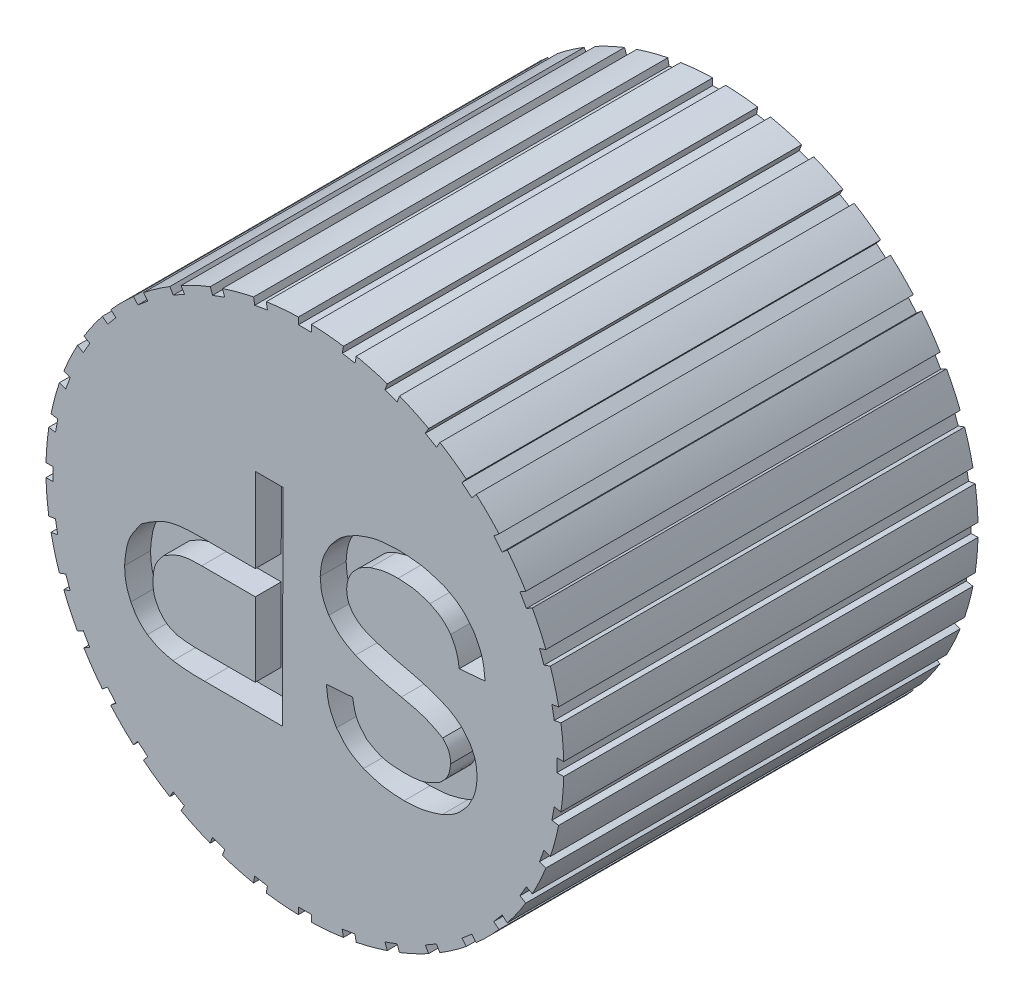
from build123d import *

# Parameters (mm, degrees)
SKETCH1_W                    = 10.000000149
SKETCH1_H                    = 16
CUT_EXTRUDE1_DEPTH           = 16
CUT_EXTRUDE2_DEPTH           = 16
CUT_EXTRUDE3_DEPTH           = 16
CUT_EXTRUDE4_DEPTH           = 16
CUT_EXTRUDE5_DEPTH           = 16
CUT_EXTRUDE6_DEPTH           = 16
CUT_EXTRUDE7_DEPTH           = 16
CUT_EXTRUDE8_DEPTH           = 16
CUT_EXTRUDE9_DEPTH           = 16
CUT_EXTRUDE10_DEPTH          = 16
CUT_EXTRUDE11_DEPTH          = 16
CUT_EXTRUDE12_DEPTH          = 16
CUT_EXTRUDE13_DEPTH          = 16
CUT_EXTRUDE14_DEPTH          = 16
CUT_EXTRUDE15_DEPTH          = 16
CUT_EXTRUDE16_DEPTH          = 16
CUT_EXTRUDE17_DEPTH          = 16
CUT_EXTRUDE18_DEPTH          = 16
CUT_EXTRUDE19_DEPTH          = 16
CUT_EXTRUDE20_DEPTH          = 16
CUT_EXTRUDE21_DEPTH          = 16
CUT_EXTRUDE22_DEPTH          = 16
CUT_EXTRUDE23_DEPTH          = 16
CUT_EXTRUDE24_DEPTH          = 16
CUT_EXTRUDE25_DEPTH          = 16
CUT_EXTRUDE26_DEPTH          = 16
CUT_EXTRUDE27_DEPTH          = 16
CUT_EXTRUDE28_DEPTH          = 16
CUT_EXTRUDE29_DEPTH          = 16
CUT_EXTRUDE30_DEPTH          = 16
CUT_EXTRUDE31_DEPTH          = 16
CUT_EXTRUDE32_DEPTH          = 16
CUT_EXTRUDE33_DEPTH          = 16
CUT_EXTRUDE34_DEPTH          = 16
CUT_EXTRUDE35_DEPTH          = 16
CUT_EXTRUDE36_DEPTH          = 16
F_6_0_6_DIAMETER_HOLE1_D     = 6
F_6_0_6_DIAMETER_HOLE1_DEPTH = 14
BOSS_EXTRUDE1_DEPTH          = 11.5
CUT_EXTRUDE37_START          = 3
CUT_EXTRUDE37_DEPTH          = 1
BOSS_EXTRUDE2_START          = 2.999997
BOSS_EXTRUDE2_DEPTH          = 1
CUT_EXTRUDE38_START          = 3
CUT_EXTRUDE38_DEPTH          = 1


with BuildPart() as part:
    # Sketch1 → Revolve1 (revolve)
    with BuildSketch(Plane(origin=(0, 0, 0), x_dir=(1, 0, 0), z_dir=(0, 1, 0))):
        with Locations((5.000000074, -8)):
            Rectangle(SKETCH1_W, SKETCH1_H)
    revolve(axis=Axis((0, 0, 0), (0, 0, 1)))

    # Sketch2 → Cut-Extrude1 (cut)
    with BuildSketch(Plane(origin=(0, 0, 0), x_dir=(-1, 0, 0), z_dir=(0, 0, -1))):
        with BuildLine():
            Line((3.182999705, 9.479900625), (3.093633551, 9.234369134))
            Line((3.093633551, 9.234369134), (3.563197034, 9.063462003))
            Line((3.563197034, 9.063462003), (3.65258757, 9.30906048))
            ThreePointArc((3.65258757, 9.30906048), (3.418860912, 9.397414168), (3.182999705, 9.479900625))
        make_face()
    extrude(amount=-CUT_EXTRUDE1_DEPTH, mode=Mode.SUBTRACT)

    # Sketch3 → Cut-Extrude2 (cut)
    with BuildSketch(Plane(origin=(0, 0, 0), x_dir=(-1, 0, 0), z_dir=(0, 0, -1))):
        with BuildLine():
            Line((4.780810256, 8.783157535), (4.650165678, 8.556874488))
            Line((4.650165678, 8.556874488), (5.082917725, 8.307024978))
            Line((5.082917725, 8.307024978), (5.213597945, 8.533369759))
            ThreePointArc((5.213597945, 8.533369759), (4.998764578, 8.660967364), (4.780810256, 8.783157535))
        make_face()
    extrude(amount=-CUT_EXTRUDE2_DEPTH, mode=Mode.SUBTRACT)

    # Sketch4 → Cut-Extrude3 (cut)
    with BuildSketch(Plane(origin=(0, 0, 0), x_dir=(-1, 0, 0), z_dir=(0, 0, -1))):
        with BuildLine():
            Line((6.233358306, 7.819542647), (6.065404874, 7.619383542))
            Line((6.065404874, 7.619383542), (6.448196533, 7.298183202))
            Line((6.448196533, 7.298183202), (6.616195786, 7.498396916))
            ThreePointArc((6.616195786, 7.498396916), (6.426783311, 7.661361449), (6.233358306, 7.819542647))
        make_face()
    extrude(amount=-CUT_EXTRUDE3_DEPTH, mode=Mode.SUBTRACT)

    # Sketch5 → Cut-Extrude4 (cut)
    with BuildSketch(Plane(origin=(0, 0, 0), x_dir=(-1, 0, 0), z_dir=(0, 0, -1))):
        with BuildLine():
            Line((7.496508918, 6.618334914), (7.296349812, 6.450381482))
            Line((7.296349812, 6.450381482), (7.617550152, 6.067589824))
            Line((7.617550152, 6.067589824), (7.817763865, 6.235589077))
            ThreePointArc((7.817763865, 6.235589077), (7.659527486, 6.428968943), (7.496508918, 6.618334914))
        make_face()
    extrude(amount=-CUT_EXTRUDE4_DEPTH, mode=Mode.SUBTRACT)

    # Sketch6 → Cut-Extrude5 (cut)
    with BuildSketch(Plane(origin=(0, 0, 0), x_dir=(-1, 0, 0), z_dir=(0, 0, -1))):
        with BuildLine():
            Line((8.531881899, 5.216032423), (8.305598853, 5.085387845))
            Line((8.305598853, 5.085387845), (8.555448364, 4.652635798))
            Line((8.555448364, 4.652635798), (8.781793145, 4.783316019))
            ThreePointArc((8.781793145, 4.783316019), (8.659540794, 5.001235469), (8.531881899, 5.216032423))
        make_face()
    extrude(amount=-CUT_EXTRUDE5_DEPTH, mode=Mode.SUBTRACT)

    # Sketch7 → Cut-Extrude6 (cut)
    with BuildSketch(Plane(origin=(0, 0, 0), x_dir=(-1, 0, 0), z_dir=(0, 0, -1))):
        with BuildLine():
            Line((9.308017967, 3.655243426), (9.062486476, 3.565877272))
            Line((9.062486476, 3.565877272), (9.233393607, 3.096313789))
            Line((9.233393607, 3.096313789), (9.478992085, 3.185704324))
            ThreePointArc((9.478992085, 3.185704324), (9.396438337, 3.421541987), (9.308017967, 3.655243426))
        make_face()
    extrude(amount=-CUT_EXTRUDE6_DEPTH, mode=Mode.SUBTRACT)

    # Sketch8 → Cut-Extrude7 (cut)
    with BuildSketch(Plane(origin=(0, 0, 0), x_dir=(-1, 0, 0), z_dir=(0, 0, -1))):
        with BuildLine():
            Line((9.801334619, 1.983391707), (9.544015033, 1.938019322))
            Line((9.544015033, 1.938019322), (9.630786858, 1.445911851))
            Line((9.630786858, 1.445911851), (9.888176646, 1.491296615))
            ThreePointArc((9.888176646, 1.491296615), (9.847829855, 1.737886682), (9.801334619, 1.983391707))
        make_face()
    extrude(amount=-CUT_EXTRUDE7_DEPTH, mode=Mode.SUBTRACT)

    # Sketch9 → Cut-Extrude8 (cut)
    with BuildSketch(Plane(origin=(0, 0, 0), x_dir=(-1, 0, 0), z_dir=(0, 0, -1))):
        with BuildLine():
            Line((9.996842678, 0.251275635), (9.735553523, 0.251275635))
            Line((9.735553523, 0.251275635), (9.735553523, -0.248423386))
            Line((9.735553523, -0.248423386), (9.996913964, -0.248423386))
            ThreePointArc((9.996913964, -0.248423386), (10.000000047, 0.00142657), (9.996842678, 0.251275635))
        make_face()
    extrude(amount=-CUT_EXTRUDE8_DEPTH, mode=Mode.SUBTRACT)

    # Sketch10 → Cut-Extrude9 (cut)
    with BuildSketch(Plane(origin=(0, 0, 0), x_dir=(-1, 0, 0), z_dir=(0, 0, -1))):
        with BuildLine():
            Line((9.888601731, -1.48847532), (9.631282146, -1.443102934))
            Line((9.631282146, -1.443102934), (9.544510321, -1.935210405))
            Line((9.544510321, -1.935210405), (9.80190011, -1.980595169))
            ThreePointArc((9.80190011, -1.980595169), (9.848325298, -1.735076888), (9.888601731, -1.48847532))
        make_face()
    extrude(amount=-CUT_EXTRUDE9_DEPTH, mode=Mode.SUBTRACT)

    # Sketch11 → Cut-Extrude10 (cut)
    with BuildSketch(Plane(origin=(0, 0, 0), x_dir=(-1, 0, 0), z_dir=(0, 0, -1))):
        with BuildLine():
            Line((9.479900625, -3.182999705), (9.234369134, -3.093633551))
            Line((9.234369134, -3.093633551), (9.063462003, -3.563197034))
            Line((9.063462003, -3.563197034), (9.30906048, -3.65258757))
            ThreePointArc((9.30906048, -3.65258757), (9.397414168, -3.418860912), (9.479900625, -3.182999705))
        make_face()
    extrude(amount=-CUT_EXTRUDE10_DEPTH, mode=Mode.SUBTRACT)

    # Sketch12 → Cut-Extrude11 (cut)
    with BuildSketch(Plane(origin=(0, 0, 0), x_dir=(-1, 0, 0), z_dir=(0, 0, -1))):
        with BuildLine():
            Line((8.783157535, -4.780810256), (8.556874488, -4.650165678))
            Line((8.556874488, -4.650165678), (8.307024978, -5.082917725))
            Line((8.307024978, -5.082917725), (8.533369759, -5.213597945))
            ThreePointArc((8.533369759, -5.213597945), (8.660967364, -4.998764578), (8.783157535, -4.780810256))
        make_face()
    extrude(amount=-CUT_EXTRUDE11_DEPTH, mode=Mode.SUBTRACT)

    # Sketch13 → Cut-Extrude12 (cut)
    with BuildSketch(Plane(origin=(0, 0, 0), x_dir=(-1, 0, 0), z_dir=(0, 0, -1))):
        with BuildLine():
            Line((7.819542647, -6.233358306), (7.619383542, -6.065404874))
            Line((7.619383542, -6.065404874), (7.298183202, -6.448196533))
            Line((7.298183202, -6.448196533), (7.498396916, -6.616195786))
            ThreePointArc((7.498396916, -6.616195786), (7.661361449, -6.426783311), (7.819542647, -6.233358306))
        make_face()
    extrude(amount=-CUT_EXTRUDE12_DEPTH, mode=Mode.SUBTRACT)

    # Sketch14 → Cut-Extrude13 (cut)
    with BuildSketch(Plane(origin=(0, 0, 0), x_dir=(-1, 0, 0), z_dir=(0, 0, -1))):
        with BuildLine():
            Line((6.618334914, -7.496508918), (6.450381482, -7.296349812))
            Line((6.450381482, -7.296349812), (6.067589824, -7.617550152))
            Line((6.067589824, -7.617550152), (6.235589077, -7.817763865))
            ThreePointArc((6.235589077, -7.817763865), (6.428968943, -7.659527486), (6.618334914, -7.496508918))
        make_face()
    extrude(amount=-CUT_EXTRUDE13_DEPTH, mode=Mode.SUBTRACT)

    # Sketch15 → Cut-Extrude14 (cut)
    with BuildSketch(Plane(origin=(0, 0, 0), x_dir=(-1, 0, 0), z_dir=(0, 0, -1))):
        with BuildLine():
            Line((5.216032423, -8.531881899), (5.085387845, -8.305598853))
            Line((5.085387845, -8.305598853), (4.652635798, -8.555448364))
            Line((4.652635798, -8.555448364), (4.783316019, -8.781793145))
            ThreePointArc((4.783316019, -8.781793145), (5.001235469, -8.659540794), (5.216032423, -8.531881899))
        make_face()
    extrude(amount=-CUT_EXTRUDE14_DEPTH, mode=Mode.SUBTRACT)

    # Sketch16 → Cut-Extrude15 (cut)
    with BuildSketch(Plane(origin=(0, 0, 0), x_dir=(-1, 0, 0), z_dir=(0, 0, -1))):
        with BuildLine():
            Line((3.655243426, -9.308017967), (3.565877272, -9.062486476))
            Line((3.565877272, -9.062486476), (3.096313789, -9.233393607))
            Line((3.096313789, -9.233393607), (3.185704324, -9.478992085))
            ThreePointArc((3.185704324, -9.478992085), (3.421541987, -9.396438337), (3.655243426, -9.308017967))
        make_face()
    extrude(amount=-CUT_EXTRUDE15_DEPTH, mode=Mode.SUBTRACT)

    # Sketch17 → Cut-Extrude16 (cut)
    with BuildSketch(Plane(origin=(0, 0, 0), x_dir=(-1, 0, 0), z_dir=(0, 0, -1))):
        with BuildLine():
            Line((1.983391707, -9.801334619), (1.938019322, -9.544015033))
            Line((1.938019322, -9.544015033), (1.445911851, -9.630786858))
            Line((1.445911851, -9.630786858), (1.491296615, -9.888176646))
            ThreePointArc((1.491296615, -9.888176646), (1.737886682, -9.847829855), (1.983391707, -9.801334619))
        make_face()
    extrude(amount=-CUT_EXTRUDE16_DEPTH, mode=Mode.SUBTRACT)

    # Sketch18 → Cut-Extrude17 (cut)
    with BuildSketch(Plane(origin=(0, 0, 0), x_dir=(-1, 0, 0), z_dir=(0, 0, -1))):
        with BuildLine():
            Line((0.251275635, -9.996842678), (0.251275635, -9.735553523))
            Line((0.251275635, -9.735553523), (-0.248423386, -9.735553523))
            Line((-0.248423386, -9.735553523), (-0.248423386, -9.996913964))
            ThreePointArc((-0.248423386, -9.996913964), (0.00142657, -10.000000047), (0.251275635, -9.996842678))
        make_face()
    extrude(amount=-CUT_EXTRUDE17_DEPTH, mode=Mode.SUBTRACT)

    # Sketch19 → Cut-Extrude18 (cut)
    with BuildSketch(Plane(origin=(0, 0, 0), x_dir=(-1, 0, 0), z_dir=(0, 0, -1))):
        with BuildLine():
            Line((-1.48847532, -9.888601731), (-1.443102934, -9.631282146))
            Line((-1.443102934, -9.631282146), (-1.935210405, -9.544510321))
            Line((-1.935210405, -9.544510321), (-1.980595169, -9.80190011))
            ThreePointArc((-1.980595169, -9.80190011), (-1.735076888, -9.848325298), (-1.48847532, -9.888601731))
        make_face()
    extrude(amount=-CUT_EXTRUDE18_DEPTH, mode=Mode.SUBTRACT)

    # Sketch20 → Cut-Extrude19 (cut)
    with BuildSketch(Plane(origin=(0, 0, 0), x_dir=(-1, 0, 0), z_dir=(0, 0, -1))):
        with BuildLine():
            Line((-3.182999705, -9.479900625), (-3.093633551, -9.234369134))
            Line((-3.093633551, -9.234369134), (-3.563197034, -9.063462003))
            Line((-3.563197034, -9.063462003), (-3.65258757, -9.30906048))
            ThreePointArc((-3.65258757, -9.30906048), (-3.418860912, -9.397414168), (-3.182999705, -9.479900625))
        make_face()
    extrude(amount=-CUT_EXTRUDE19_DEPTH, mode=Mode.SUBTRACT)

    # Sketch21 → Cut-Extrude20 (cut)
    with BuildSketch(Plane(origin=(0, 0, 0), x_dir=(-1, 0, 0), z_dir=(0, 0, -1))):
        with BuildLine():
            Line((-4.780810256, -8.783157535), (-4.650165678, -8.556874488))
            Line((-4.650165678, -8.556874488), (-5.082917725, -8.307024978))
            Line((-5.082917725, -8.307024978), (-5.213597945, -8.533369759))
            ThreePointArc((-5.213597945, -8.533369759), (-4.998764578, -8.660967364), (-4.780810256, -8.783157535))
        make_face()
    extrude(amount=-CUT_EXTRUDE20_DEPTH, mode=Mode.SUBTRACT)

    # Sketch22 → Cut-Extrude21 (cut)
    with BuildSketch(Plane(origin=(0, 0, 0), x_dir=(-1, 0, 0), z_dir=(0, 0, -1))):
        with BuildLine():
            Line((-6.233358306, -7.819542647), (-6.065404874, -7.619383542))
            Line((-6.065404874, -7.619383542), (-6.448196533, -7.298183202))
            Line((-6.448196533, -7.298183202), (-6.616195786, -7.498396916))
            ThreePointArc((-6.616195786, -7.498396916), (-6.426783311, -7.661361449), (-6.233358306, -7.819542647))
        make_face()
    extrude(amount=-CUT_EXTRUDE21_DEPTH, mode=Mode.SUBTRACT)

    # Sketch23 → Cut-Extrude22 (cut)
    with BuildSketch(Plane(origin=(0, 0, 0), x_dir=(-1, 0, 0), z_dir=(0, 0, -1))):
        with BuildLine():
            Line((-7.496508918, -6.618334914), (-7.296349812, -6.450381482))
            Line((-7.296349812, -6.450381482), (-7.617550152, -6.067589824))
            Line((-7.617550152, -6.067589824), (-7.817763865, -6.235589077))
            ThreePointArc((-7.817763865, -6.235589077), (-7.659527486, -6.428968943), (-7.496508918, -6.618334914))
        make_face()
    extrude(amount=-CUT_EXTRUDE22_DEPTH, mode=Mode.SUBTRACT)

    # Sketch24 → Cut-Extrude23 (cut)
    with BuildSketch(Plane(origin=(0, 0, 0), x_dir=(-1, 0, 0), z_dir=(0, 0, -1))):
        with BuildLine():
            Line((-8.531881899, -5.216032423), (-8.305598853, -5.085387845))
            Line((-8.305598853, -5.085387845), (-8.555448364, -4.652635798))
            Line((-8.555448364, -4.652635798), (-8.781793145, -4.783316019))
            ThreePointArc((-8.781793145, -4.783316019), (-8.659540794, -5.001235469), (-8.531881899, -5.216032423))
        make_face()
    extrude(amount=-CUT_EXTRUDE23_DEPTH, mode=Mode.SUBTRACT)

    # Sketch25 → Cut-Extrude24 (cut)
    with BuildSketch(Plane(origin=(0, 0, 0), x_dir=(-1, 0, 0), z_dir=(0, 0, -1))):
        with BuildLine():
            Line((-9.308017967, -3.655243426), (-9.062486476, -3.565877272))
            Line((-9.062486476, -3.565877272), (-9.233393607, -3.096313789))
            Line((-9.233393607, -3.096313789), (-9.478992085, -3.185704324))
            ThreePointArc((-9.478992085, -3.185704324), (-9.396438337, -3.421541987), (-9.308017967, -3.655243426))
        make_face()
    extrude(amount=-CUT_EXTRUDE24_DEPTH, mode=Mode.SUBTRACT)

    # Sketch26 → Cut-Extrude25 (cut)
    with BuildSketch(Plane(origin=(0, 0, 0), x_dir=(-1, 0, 0), z_dir=(0, 0, -1))):
        with BuildLine():
            Line((-9.801334619, -1.983391707), (-9.544015033, -1.938019322))
            Line((-9.544015033, -1.938019322), (-9.630786858, -1.445911851))
            Line((-9.630786858, -1.445911851), (-9.888176646, -1.491296615))
            ThreePointArc((-9.888176646, -1.491296615), (-9.847829855, -1.737886682), (-9.801334619, -1.983391707))
        make_face()
    extrude(amount=-CUT_EXTRUDE25_DEPTH, mode=Mode.SUBTRACT)

    # Sketch27 → Cut-Extrude26 (cut)
    with BuildSketch(Plane(origin=(0, 0, 0), x_dir=(-1, 0, 0), z_dir=(0, 0, -1))):
        with BuildLine():
            Line((-9.996842678, -0.251275635), (-9.735553523, -0.251275635))
            Line((-9.735553523, -0.251275635), (-9.735553523, 0.248423386))
            Line((-9.735553523, 0.248423386), (-9.996913964, 0.248423386))
            ThreePointArc((-9.996913964, 0.248423386), (-10.000000047, -0.00142657), (-9.996842678, -0.251275635))
        make_face()
    extrude(amount=-CUT_EXTRUDE26_DEPTH, mode=Mode.SUBTRACT)

    # Sketch28 → Cut-Extrude27 (cut)
    with BuildSketch(Plane(origin=(0, 0, 0), x_dir=(-1, 0, 0), z_dir=(0, 0, -1))):
        with BuildLine():
            Line((-9.888601731, 1.48847532), (-9.631282146, 1.443102934))
            Line((-9.631282146, 1.443102934), (-9.544510321, 1.935210405))
            Line((-9.544510321, 1.935210405), (-9.80190011, 1.980595169))
            ThreePointArc((-9.80190011, 1.980595169), (-9.848325298, 1.735076888), (-9.888601731, 1.48847532))
        make_face()
    extrude(amount=-CUT_EXTRUDE27_DEPTH, mode=Mode.SUBTRACT)

    # Sketch29 → Cut-Extrude28 (cut)
    with BuildSketch(Plane(origin=(0, 0, 0), x_dir=(-1, 0, 0), z_dir=(0, 0, -1))):
        with BuildLine():
            Line((-9.479900625, 3.182999705), (-9.234369134, 3.093633551))
            Line((-9.234369134, 3.093633551), (-9.063462003, 3.563197034))
            Line((-9.063462003, 3.563197034), (-9.30906048, 3.65258757))
            ThreePointArc((-9.30906048, 3.65258757), (-9.397414168, 3.418860912), (-9.479900625, 3.182999705))
        make_face()
    extrude(amount=-CUT_EXTRUDE28_DEPTH, mode=Mode.SUBTRACT)

    # Sketch30 → Cut-Extrude29 (cut)
    with BuildSketch(Plane(origin=(0, 0, 0), x_dir=(-1, 0, 0), z_dir=(0, 0, -1))):
        with BuildLine():
            Line((-8.783157535, 4.780810256), (-8.556874488, 4.650165678))
            Line((-8.556874488, 4.650165678), (-8.307024978, 5.082917725))
            Line((-8.307024978, 5.082917725), (-8.533369759, 5.213597945))
            ThreePointArc((-8.533369759, 5.213597945), (-8.660967364, 4.998764578), (-8.783157535, 4.780810256))
        make_face()
    extrude(amount=-CUT_EXTRUDE29_DEPTH, mode=Mode.SUBTRACT)

    # Sketch31 → Cut-Extrude30 (cut)
    with BuildSketch(Plane(origin=(0, 0, 0), x_dir=(-1, 0, 0), z_dir=(0, 0, -1))):
        with BuildLine():
            Line((-7.819542647, 6.233358306), (-7.619383542, 6.065404874))
            Line((-7.619383542, 6.065404874), (-7.298183202, 6.448196533))
            Line((-7.298183202, 6.448196533), (-7.498396916, 6.616195786))
            ThreePointArc((-7.498396916, 6.616195786), (-7.661361449, 6.426783311), (-7.819542647, 6.233358306))
        make_face()
    extrude(amount=-CUT_EXTRUDE30_DEPTH, mode=Mode.SUBTRACT)

    # Sketch32 → Cut-Extrude31 (cut)
    with BuildSketch(Plane(origin=(0, 0, 0), x_dir=(-1, 0, 0), z_dir=(0, 0, -1))):
        with BuildLine():
            Line((-6.618334914, 7.496508918), (-6.450381482, 7.296349812))
            Line((-6.450381482, 7.296349812), (-6.067589824, 7.617550152))
            Line((-6.067589824, 7.617550152), (-6.235589077, 7.817763865))
            ThreePointArc((-6.235589077, 7.817763865), (-6.428968943, 7.659527486), (-6.618334914, 7.496508918))
        make_face()
    extrude(amount=-CUT_EXTRUDE31_DEPTH, mode=Mode.SUBTRACT)

    # Sketch33 → Cut-Extrude32 (cut)
    with BuildSketch(Plane(origin=(0, 0, 0), x_dir=(-1, 0, 0), z_dir=(0, 0, -1))):
        with BuildLine():
            Line((-5.216032423, 8.531881899), (-5.085387845, 8.305598853))
            Line((-5.085387845, 8.305598853), (-4.652635798, 8.555448364))
            Line((-4.652635798, 8.555448364), (-4.783316019, 8.781793145))
            ThreePointArc((-4.783316019, 8.781793145), (-5.001235469, 8.659540794), (-5.216032423, 8.531881899))
        make_face()
    extrude(amount=-CUT_EXTRUDE32_DEPTH, mode=Mode.SUBTRACT)

    # Sketch34 → Cut-Extrude33 (cut)
    with BuildSketch(Plane(origin=(0, 0, 0), x_dir=(-1, 0, 0), z_dir=(0, 0, -1))):
        with BuildLine():
            Line((-3.655243426, 9.308017967), (-3.565877272, 9.062486476))
            Line((-3.565877272, 9.062486476), (-3.096313789, 9.233393607))
            Line((-3.096313789, 9.233393607), (-3.185704324, 9.478992085))
            ThreePointArc((-3.185704324, 9.478992085), (-3.421541987, 9.396438337), (-3.655243426, 9.308017967))
        make_face()
    extrude(amount=-CUT_EXTRUDE33_DEPTH, mode=Mode.SUBTRACT)

    # Sketch35 → Cut-Extrude34 (cut)
    with BuildSketch(Plane(origin=(0, 0, 0), x_dir=(-1, 0, 0), z_dir=(0, 0, -1))):
        with BuildLine():
            Line((-1.983391707, 9.801334619), (-1.938019322, 9.544015033))
            Line((-1.938019322, 9.544015033), (-1.445911851, 9.630786858))
            Line((-1.445911851, 9.630786858), (-1.491296615, 9.888176646))
            ThreePointArc((-1.491296615, 9.888176646), (-1.737886682, 9.847829855), (-1.983391707, 9.801334619))
        make_face()
    extrude(amount=-CUT_EXTRUDE34_DEPTH, mode=Mode.SUBTRACT)

    # Sketch36 → Cut-Extrude35 (cut)
    with BuildSketch(Plane(origin=(0, 0, 0), x_dir=(-1, 0, 0), z_dir=(0, 0, -1))):
        with BuildLine():
            Line((-0.251275635, 9.996842678), (-0.251275635, 9.735553523))
            Line((-0.251275635, 9.735553523), (0.248423386, 9.735553523))
            Line((0.248423386, 9.735553523), (0.248423386, 9.996913964))
            ThreePointArc((0.248423386, 9.996913964), (-0.00142657, 10.000000047), (-0.251275635, 9.996842678))
        make_face()
    extrude(amount=-CUT_EXTRUDE35_DEPTH, mode=Mode.SUBTRACT)

    # Sketch37 → Cut-Extrude36 (cut)
    with BuildSketch(Plane(origin=(0, 0, 0), x_dir=(-1, 0, 0), z_dir=(0, 0, -1))):
        with BuildLine():
            Line((1.48847532, 9.888601731), (1.443102934, 9.631282146))
            Line((1.443102934, 9.631282146), (1.935210405, 9.544510321))
            Line((1.935210405, 9.544510321), (1.980595169, 9.80190011))
            ThreePointArc((1.980595169, 9.80190011), (1.735076888, 9.848325298), (1.48847532, 9.888601731))
        make_face()
    extrude(amount=-CUT_EXTRUDE36_DEPTH, mode=Mode.SUBTRACT)

    # Ø6.0 (6) Diameter Hole1
    with Locations(Plane(origin=(0, 0, 0), x_dir=(-1, 0, 0), z_dir=(0, 0, -1))):
        with Locations((0, 0)):
            Hole(F_6_0_6_DIAMETER_HOLE1_D / 2, depth=F_6_0_6_DIAMETER_HOLE1_DEPTH)

    # Sketch40 → Boss-Extrude1 (add)
    with BuildSketch(Plane(origin=(0, 0, 14), x_dir=(-1, 0, 0), z_dir=(0, 0, -1))):
        with BuildLine():
            Line((1.984313483, 2.25), (-1.984313483, 2.25))
            ThreePointArc((-1.984313483, 2.25), (0, 3), (1.984313483, 2.25))
        make_face()
    extrude(amount=BOSS_EXTRUDE1_DEPTH)

    # Sketch41 → Cut-Extrude37 (cut)
    with BuildSketch(Plane.XY.offset(13.000000423).offset(CUT_EXTRUDE37_START)):
        with BuildLine():
            Line((-0.857613162, -3.999232423), (-3.875347428, -3.996524468))
            ThreePointArc((-3.875347428, -3.996524468), (-4.485386567, -3.983141856), (-5.09219542, -3.919033652))
            add(Edge.make_bspline(
                [(-5.09219542, -3.919033652), (-5.16161112, -3.90490142), (-5.30037334, -3.876651039), (-5.506585374, -3.824369657), (-5.706405542, -3.75006323), (-5.895789072, -3.65210041), (-6.018278364, -3.580283586), (-6.079580079, -3.544341713)],
                knots=[0, 0, 0, 0, 0.199818201, 0.399437262, 0.599468513, 0.799547646, 1, 1, 1, 1], degree=3))
            add(Edge.make_bspline(
                [(-6.079580079, -3.544341713), (-6.10862742, -3.520684404), (-6.166693383, -3.473393176), (-6.252414355, -3.40085374), (-6.335249324, -3.325019643), (-6.413731818, -3.244315047), (-6.485389591, -3.157183939), (-6.550167609, -3.064656241), (-6.60974806, -2.968730762), (-6.665782543, -2.870648814), (-6.701985456, -2.804615211), (-6.720087459, -2.771597413)],
                knots=[0, 0, 0, 0, 0.11086707, 0.221624522, 0.332283313, 0.443111901, 0.554485261, 0.665740773, 0.777134774, 0.888564024, 1, 1, 1, 1], degree=3))
            add(Edge.make_bspline(
                [(-6.720087459, -2.771597413), (-6.748671764, -2.702250422), (-6.805804741, -2.56364289), (-6.880550925, -2.351020125), (-6.928979802, -2.130369795), (-6.951233188, -1.905543003), (-6.95837353, -1.755208428), (-6.961946852, -1.679974788)],
                knots=[0, 0, 0, 0, 0.199722266, 0.39919555, 0.599257567, 0.799451909, 1, 1, 1, 1], degree=3))
            add(Edge.make_bspline(
                [(-6.961946852, -1.679974788), (-6.954966981, -1.590031811), (-6.941027409, -1.410405755), (-6.908698322, -1.142880953), (-6.853058028, -0.879907596), (-6.759092406, -0.627375441), (-6.627025804, -0.392000818), (-6.473908463, -0.169147991), (-6.365321195, -0.025337169), (-6.311010617, 0.046590682)],
                knots=[0, 0, 0, 0, 0.143507385, 0.286600092, 0.428441593, 0.570097682, 0.713347845, 0.856629194, 1, 1, 1, 1], degree=3))
            add(Edge.make_bspline(
                [(-6.311010617, 0.046590682), (-6.234131326, 0.100029489), (-6.080435417, 0.20686354), (-5.844586225, 0.359628826), (-5.598989431, 0.494848091), (-5.341531472, 0.602376545), (-5.073443088, 0.673581283), (-4.799588068, 0.716204365), (-4.522207464, 0.738746713), (-4.243176857, 0.748174047), (-4.056966138, 0.750171273), (-3.963855804, 0.751169939)],
                knots=[0, 0, 0, 0, 0.111905068, 0.223718909, 0.335717425, 0.446571888, 0.556278917, 0.666368666, 0.777426087, 0.888707097, 1, 1, 1, 1], degree=3))
            Line((-3.963855804, 0.751169939), (-1.91201561, 0.749328726))
            Line((-1.91201561, 0.749328726), (-1.90909709, 4.001714463))
            Line((-1.90909709, 4.001714463), (-0.850434387, 4.000764475))
            Line((-0.850434387, 4.000764475), (-0.857613162, -3.999232423))
        make_face()
    extrude(amount=-CUT_EXTRUDE37_DEPTH, mode=Mode.SUBTRACT)

    # Sketch42 → Boss-Extrude2 (add)
    with BuildSketch(Plane.YX.offset(-17.999997077).offset(BOSS_EXTRUDE2_START)):
        with BuildLine():
            Line((-3.052381047, -3.961812699), (-3.054217364, -1.915428712))
            Line((-3.054217364, -1.915428712), (-0.194736942, -1.912862765))
            Line((-0.194736942, -1.912862765), (-0.192881037, -3.981075156))
            add(Edge.make_bspline(
                [(-0.192881037, -3.981075156), (-0.193455705, -4.038043383), (-0.194604991, -4.151974925), (-0.199776606, -4.322715995), (-0.212260421, -4.492542321), (-0.235715368, -4.660406547), (-0.274240915, -4.825144332), (-0.331863284, -4.984963445), (-0.40435653, -5.139678976), (-0.486784254, -5.290224928), (-0.544636447, -5.389034085), (-0.573565289, -5.438443354)],
                knots=[0, 0, 0, 0, 0.111440731, 0.222871854, 0.334089572, 0.444372445, 0.554108964, 0.664377474, 0.776028214, 0.888003477, 1, 1, 1, 1], degree=3))
            add(Edge.make_bspline(
                [(-0.573565289, -5.438443354), (-0.607058836, -5.467366336), (-0.674027213, -5.525196138), (-0.777164419, -5.608858574), (-0.885293109, -5.68548289), (-1.000369134, -5.750839911), (-1.12390679, -5.798681957), (-1.25270645, -5.829881289), (-1.383938636, -5.849613538), (-1.515928658, -5.861868272), (-1.604100937, -5.867629401), (-1.648211552, -5.870511565)],
                knots=[0, 0, 0, 0, 0.111393812, 0.222725373, 0.334165356, 0.444661256, 0.554940814, 0.66641958, 0.777581427, 0.888728975, 1, 1, 1, 1], degree=3))
            add(Edge.make_bspline(
                [(-1.648211552, -5.870511565), (-1.681966532, -5.868646645), (-1.749473351, -5.864916981), (-1.850549019, -5.857193052), (-1.950894315, -5.84509581), (-2.049830459, -5.82649631), (-2.146419548, -5.798757094), (-2.239923706, -5.76121065), (-2.3309055, -5.716944236), (-2.419969165, -5.668262936), (-2.478602094, -5.634442859), (-2.507920601, -5.617531642)],
                knots=[0, 0, 0, 0, 0.111518611, 0.223026848, 0.334339708, 0.444774234, 0.554758028, 0.665246244, 0.776716095, 0.888350267, 1, 1, 1, 1], degree=3))
            add(Edge.make_bspline(
                [(-2.507920601, -5.617531642), (-2.550931515, -5.58167371), (-2.636628994, -5.510228252), (-2.756452321, -5.393823216), (-2.852990244, -5.257477432), (-2.92260992, -5.106060536), (-2.961186863, -5.001807523), (-2.980553298, -4.949470324)],
                knots=[0, 0, 0, 0, 0.201651557, 0.401782446, 0.599696701, 0.799039349, 1, 1, 1, 1], degree=3))
            ThreePointArc((-2.980553298, -4.949470324), (-3.043197184, -4.457585461), (-3.052381047, -3.961812699))
        make_face()
    extrude(amount=-BOSS_EXTRUDE2_DEPTH)

    # Sketch43 → Cut-Extrude38 (cut)
    with BuildSketch(Plane.XY.offset(13.000000423).offset(CUT_EXTRUDE38_START)):
        with BuildLine():
            Line((0.830629321, -1.746994701), (1.845704368, -1.671507292))
            add(Edge.make_bspline(
                [(1.845704368, -1.671507292), (1.853466612, -1.719172249), (1.868982898, -1.8144518), (1.89582064, -1.95674485), (1.930051081, -2.097628796), (1.975386803, -2.235281645), (2.03651159, -2.366700796), (2.114557764, -2.488682961), (2.203575579, -2.603018762), (2.299553042, -2.711912748), (2.365555545, -2.782618817), (2.39856389, -2.81797945)],
                knots=[0, 0, 0, 0, 0.111175102, 0.222232733, 0.333272757, 0.444721153, 0.555341655, 0.66595009, 0.777328969, 0.888640553, 1, 1, 1, 1], degree=3))
            add(Edge.make_bspline(
                [(2.39856389, -2.81797945), (2.458988144, -2.853862924), (2.579803321, -2.92561008), (2.765643755, -3.025065859), (2.959830995, -3.106569278), (3.163449781, -3.159162126), (3.371544294, -3.187497682), (3.581624451, -3.200776888), (3.722167074, -3.204710811), (3.792486013, -3.206679106)],
                knots=[0, 0, 0, 0, 0.143205564, 0.286332136, 0.429271185, 0.571216063, 0.713489124, 0.856647469, 1, 1, 1, 1], degree=3))
            add(Edge.make_bspline(
                [(3.792486013, -3.206679106), (3.862531067, -3.205708896), (4.002554995, -3.203769392), (4.212033618, -3.193965851), (4.419885002, -3.170100292), (4.624043401, -3.123778156), (4.820121752, -3.049546292), (5.008423454, -2.956902094), (5.131151132, -2.889610074), (5.192528313, -2.855956748)],
                knots=[0, 0, 0, 0, 0.143330325, 0.286525231, 0.428918696, 0.570897345, 0.713626638, 0.856782185, 1, 1, 1, 1], degree=3))
            add(Edge.make_bspline(
                [(5.192528313, -2.855956748), (5.227116487, -2.823669914), (5.296191542, -2.759190797), (5.394625353, -2.657863386), (5.481690363, -2.547012986), (5.548033635, -2.422112545), (5.588879457, -2.286728766), (5.614459691, -2.147741662), (5.6265372, -2.054458018), (5.632580149, -2.0077838)],
                knots=[0, 0, 0, 0, 0.143802065, 0.287183003, 0.429026075, 0.570787489, 0.71413963, 0.856970541, 1, 1, 1, 1], degree=3))
            add(Edge.make_bspline(
                [(5.632580149, -2.0077838), (5.629202196, -1.969736508), (5.622455831, -1.89374939), (5.606922523, -1.78067959), (5.579906257, -1.669885676), (5.534249434, -1.565120065), (5.470949747, -1.47020331), (5.398607835, -1.382266199), (5.347661155, -1.326165535), (5.322166449, -1.298091676)],
                knots=[0, 0, 0, 0, 0.143771538, 0.287136983, 0.429296071, 0.571646609, 0.714769544, 0.857265155, 1, 1, 1, 1], degree=3))
            add(Edge.make_bspline(
                [(5.322166449, -1.298091676), (5.267130142, -1.267358985), (5.157116826, -1.205926716), (4.990386336, -1.117045291), (4.819914677, -1.035484583), (4.644535915, -0.964193852), (4.464778803, -0.903779971), (4.282121347, -0.851943088), (4.097751344, -0.806527262), (3.912352454, -0.765412899), (3.788450381, -0.739404725), (3.726498611, -0.726400484)],
                knots=[0, 0, 0, 0, 0.110910635, 0.221701773, 0.332390466, 0.443258593, 0.554572906, 0.665882395, 0.777244518, 0.888620943, 1, 1, 1, 1], degree=3))
            ThreePointArc((3.726498611, -0.726400484), (2.830279875, -0.508696524), (1.956152655, -0.214579811))
            add(Edge.make_bspline(
                [(1.956152655, -0.214579811), (1.876987621, -0.174310194), (1.718864889, -0.093876429), (1.488963719, 0.040187462), (1.278420586, 0.203709568), (1.095376841, 0.397193099), (0.982192117, 0.533770491), (0.925507237, 0.602170827)],
                knots=[0, 0, 0, 0, 0.200430557, 0.400336182, 0.59968356, 0.799514557, 1, 1, 1, 1], degree=3))
            add(Edge.make_bspline(
                [(0.925507237, 0.602170827), (0.903654871, 0.641173466), (0.85995188, 0.719175637), (0.79696323, 0.837496056), (0.739586184, 0.958170283), (0.690700338, 1.081952258), (0.653977725, 1.209570531), (0.628988798, 1.340279712), (0.612476459, 1.472865272), (0.601697057, 1.606434009), (0.596332119, 1.695649512), (0.593649535, 1.740259161)],
                knots=[0, 0, 0, 0, 0.111606215, 0.223203535, 0.334559996, 0.445013927, 0.555046333, 0.665530802, 0.776881766, 0.888436138, 1, 1, 1, 1], degree=3))
            add(Edge.make_bspline(
                [(0.593649535, 1.740259161), (0.600181023, 1.825093335), (0.61322245, 1.994481811), (0.6495027, 2.24694002), (0.724548604, 2.491117861), (0.835195212, 2.720934246), (0.918584964, 2.8690315), (0.960349994, 2.943204718)],
                knots=[0, 0, 0, 0, 0.200474206, 0.400287035, 0.599555025, 0.799440628, 1, 1, 1, 1], degree=3))
            add(Edge.make_bspline(
                [(0.960349994, 2.943204718), (0.991685244, 2.98371667), (1.054318524, 3.064692455), (1.150727598, 3.184137475), (1.252174637, 3.299361027), (1.361079996, 3.408190826), (1.479886661, 3.50672962), (1.607010986, 3.594654485), (1.739256703, 3.674568454), (1.87472617, 3.749024698), (1.965984222, 3.796902643), (2.011614991, 3.820842531)],
                knots=[0, 0, 0, 0, 0.110821598, 0.22151157, 0.332084249, 0.442865985, 0.554295686, 0.665563631, 0.777010376, 0.888500928, 1, 1, 1, 1], degree=3))
            add(Edge.make_bspline(
                [(2.011614991, 3.820842531), (2.066371089, 3.84167112), (2.175844638, 3.883313598), (2.340996384, 3.943125058), (2.508028639, 3.997496973), (2.677787667, 4.04377274), (2.850609713, 4.078203664), (3.025451161, 4.10138599), (3.20114527, 4.116502074), (3.37726249, 4.12618976), (3.494757326, 4.130888661), (3.553506001, 4.133238161)],
                knots=[0, 0, 0, 0, 0.110939398, 0.221800496, 0.332591714, 0.443501627, 0.554796702, 0.666012342, 0.77732368, 0.888659456, 1, 1, 1, 1], degree=3))
            add(Edge.make_bspline(
                [(3.553506001, 4.133238161), (3.622253754, 4.131439614), (3.75971525, 4.127843409), (3.96578265, 4.119708591), (4.171561045, 4.105914959), (4.376814748, 4.083664727), (4.580672134, 4.049733489), (4.781908801, 4.002165985), (4.980598469, 3.945133488), (5.177393658, 3.881697897), (5.307889793, 3.837297899), (5.373139407, 3.815097374)],
                knots=[0, 0, 0, 0, 0.111015514, 0.221976108, 0.332886984, 0.443880757, 0.555125601, 0.666254959, 0.777484515, 0.888739622, 1, 1, 1, 1], degree=3))
            add(Edge.make_bspline(
                [(5.373139407, 3.815097374), (5.423274658, 3.789520182), (5.523540163, 3.738368347), (5.672276286, 3.658587411), (5.817098741, 3.572799056), (5.955655397, 3.478314716), (6.084779348, 3.371822184), (6.20360346, 3.253473545), (6.314797152, 3.127098786), (6.420629361, 2.995582564), (6.489353321, 2.906404627), (6.523716913, 2.861813566)],
                knots=[0, 0, 0, 0, 0.111529501, 0.223047882, 0.334405635, 0.44493927, 0.555034674, 0.665542225, 0.776899083, 0.888444309, 1, 1, 1, 1], degree=3))
            add(Edge.make_bspline(
                [(6.523716913, 2.861813566), (6.550995346, 2.812653021), (6.605522695, 2.714385124), (6.684315959, 2.565424648), (6.756949661, 2.413335491), (6.820264754, 2.256664051), (6.869420105, 2.094598156), (6.904362905, 1.928686411), (6.92912109, 1.761023625), (6.94705734, 1.592417489), (6.956830346, 1.479803509), (6.961717046, 1.423494252)],
                knots=[0, 0, 0, 0, 0.110861933, 0.221603911, 0.332241754, 0.443079884, 0.554483955, 0.665701668, 0.777104809, 0.888547919, 1, 1, 1, 1], degree=3))
            Line((6.961717046, 1.423494252), (5.963003359, 1.33707795))
            add(Edge.make_bspline(
                [(5.963003359, 1.33707795), (5.952632441, 1.406063967), (5.931902373, 1.543957716), (5.890389092, 1.749306502), (5.825598193, 1.949074735), (5.735011441, 2.138582775), (5.667520507, 2.261060307), (5.633737395, 2.32236739)],
                knots=[0, 0, 0, 0, 0.199817364, 0.399407977, 0.599425413, 0.79948927, 1, 1, 1, 1], degree=3))
            add(Edge.make_bspline(
                [(5.633737395, 2.32236739), (5.609410062, 2.35159463), (5.560786371, 2.4100119), (5.486002456, 2.496004164), (5.407489491, 2.578624511), (5.323469203, 2.65616312), (5.232241358, 2.725590211), (5.135428884, 2.78731592), (5.035166821, 2.843215936), (4.932750987, 2.895160379), (4.863840735, 2.928513241), (4.829384405, 2.945190254)],
                knots=[0, 0, 0, 0, 0.110790411, 0.221439767, 0.331964901, 0.442710628, 0.554155492, 0.665472564, 0.776952397, 0.888472301, 1, 1, 1, 1], degree=3))
            add(Edge.make_bspline(
                [(4.829384405, 2.945190254), (4.785629723, 2.961064922), (4.698148701, 2.992803973), (4.566238816, 3.038380502), (4.43295765, 3.079799744), (4.297690961, 3.115043423), (4.160196173, 3.141279528), (4.021235686, 3.159014271), (3.881651128, 3.170641689), (3.741756062, 3.178156509), (3.648430801, 3.181833622), (3.601767264, 3.183672215)],
                knots=[0, 0, 0, 0, 0.110953584, 0.221835297, 0.332652994, 0.44357912, 0.554858124, 0.666066584, 0.777361514, 0.888678595, 1, 1, 1, 1], degree=3))
            add(Edge.make_bspline(
                [(3.601767264, 3.183672215), (3.56144132, 3.182477868), (3.480807313, 3.180089702), (3.359929037, 3.174989624), (3.239218985, 3.166738313), (3.1188041, 3.153799894), (2.999151437, 3.134382898), (2.880824073, 3.107774466), (2.763763937, 3.076165511), (2.647641817, 3.041181476), (2.570567124, 3.016760476), (2.53202906, 3.004549748)],
                knots=[0, 0, 0, 0, 0.111019814, 0.221990406, 0.332916331, 0.443916342, 0.55514554, 0.666287356, 0.777509591, 0.888752723, 1, 1, 1, 1], degree=3))
            add(Edge.make_bspline(
                [(2.53202906, 3.004549748), (2.479222657, 2.981654945), (2.373742544, 2.93592287), (2.219886557, 2.85772433), (2.078557673, 2.758757615), (1.955385789, 2.638906901), (1.879336417, 2.553871131), (1.841272298, 2.511309153)],
                knots=[0, 0, 0, 0, 0.200969825, 0.401434657, 0.601625119, 0.800605995, 1, 1, 1, 1], degree=3))
            add(Edge.make_bspline(
                [(1.841272298, 2.511309153), (1.826870012, 2.488192025), (1.79806891, 2.441963334), (1.756391176, 2.371679766), (1.718058614, 2.299731376), (1.6848991, 2.225594273), (1.659273545, 2.148765645), (1.641521729, 2.069646767), (1.629310535, 1.98919759), (1.620836689, 1.908028875), (1.616406429, 1.853781185), (1.614191179, 1.826655875)],
                knots=[0, 0, 0, 0, 0.111565762, 0.223104657, 0.334646058, 0.445332046, 0.555378391, 0.665775368, 0.777051662, 0.888519814, 1, 1, 1, 1], degree=3))
            add(Edge.make_bspline(
                [(1.614191179, 1.826655875), (1.616006403, 1.800510988), (1.619636142, 1.748231409), (1.62687323, 1.669926792), (1.637848955, 1.59218814), (1.65439207, 1.515730563), (1.6787244, 1.441636116), (1.710903433, 1.370567224), (1.748389417, 1.301863072), (1.789337077, 1.234892522), (1.817699885, 1.190890895), (1.831882171, 1.168888712)],
                knots=[0, 0, 0, 0, 0.111557582, 0.22307166, 0.334669808, 0.445560822, 0.555612716, 0.665938119, 0.777161479, 0.888573801, 1, 1, 1, 1], degree=3))
            add(Edge.make_bspline(
                [(1.831882171, 1.168888712), (1.854533125, 1.146075799), (1.899806296, 1.100478915), (1.969180285, 1.033624163), (2.0413972, 0.969840658), (2.117764585, 0.910613982), (2.199429684, 0.858461124), (2.284862818, 0.812421154), (2.372656085, 0.77106574), (2.461907287, 0.732889366), (2.521825737, 0.708436347), (2.551785801, 0.696209495)],
                knots=[0, 0, 0, 0, 0.110792585, 0.221444605, 0.331976129, 0.442715668, 0.554138879, 0.665487635, 0.776966822, 0.888480288, 1, 1, 1, 1], degree=3))
            ThreePointArc((2.551785801, 0.696209495), (3.258720917, 0.482180036), (3.975718786, 0.304754206))
            ThreePointArc((3.975718786, 0.304754206), (4.761524122, 0.097140693), (5.519608419, -0.195949046))
            add(Edge.make_bspline(
                [(5.519608419, -0.195949046), (5.556259315, -0.21715366), (5.629529756, -0.259544751), (5.73828316, -0.325010991), (5.844588892, -0.394409769), (5.947130137, -0.469665916), (6.043764719, -0.552712102), (6.132895108, -0.643940138), (6.216252148, -0.740380443), (6.295613021, -0.840207436), (6.347179789, -0.907801417), (6.37296417, -0.941599713)],
                knots=[0, 0, 0, 0, 0.110935859, 0.221776823, 0.332531526, 0.443436261, 0.554782611, 0.66593373, 0.777257771, 0.888624584, 1, 1, 1, 1], degree=3))
            add(Edge.make_bspline(
                [(6.37296417, -0.941599713), (6.405818394, -1.003372997), (6.471423577, -1.126725401), (6.557755973, -1.317873194), (6.614227386, -1.520201275), (6.640251154, -1.728354249), (6.648817061, -1.86787863), (6.653107251, -1.937758687)],
                knots=[0, 0, 0, 0, 0.200442157, 0.400254285, 0.599542665, 0.799433038, 1, 1, 1, 1], degree=3))
            add(Edge.make_bspline(
                [(6.653107251, -1.937758687), (6.647081883, -2.017605645), (6.635050652, -2.177041093), (6.601220039, -2.414689048), (6.530792132, -2.644563372), (6.426445361, -2.860774196), (6.347731134, -3.000024183), (6.308298707, -3.069782412)],
                knots=[0, 0, 0, 0, 0.200463082, 0.400277251, 0.599556774, 0.79939524, 1, 1, 1, 1], degree=3))
            add(Edge.make_bspline(
                [(6.308298707, -3.069782412), (6.278265007, -3.107771895), (6.218200219, -3.183747556), (6.125639264, -3.295613889), (6.028317536, -3.402726907), (5.92429888, -3.502499268), (5.811226716, -3.591351205), (5.690300697, -3.66972161), (5.564031063, -3.740361837), (5.434438618, -3.805653247), (5.347140054, -3.847440826), (5.30348888, -3.868335521)],
                knots=[0, 0, 0, 0, 0.111630506, 0.223251306, 0.334625326, 0.445069579, 0.555082239, 0.665556735, 0.776901532, 0.888445934, 1, 1, 1, 1], degree=3))
            add(Edge.make_bspline(
                [(5.30348888, -3.868335521), (5.250970759, -3.886432093), (5.145965376, -3.922614605), (4.987708612, -3.97456278), (4.827964908, -4.021767889), (4.666069023, -4.061930031), (4.501756734, -4.091834499), (4.335845462, -4.111997838), (4.169257259, -4.125186749), (4.002331842, -4.133676174), (3.890981189, -4.1378048), (3.835304865, -4.139869151)],
                knots=[0, 0, 0, 0, 0.110969344, 0.221873483, 0.332719675, 0.443664104, 0.554927445, 0.66612502, 0.777401894, 0.888698952, 1, 1, 1, 1], degree=3))
            add(Edge.make_bspline(
                [(3.835304865, -4.139869151), (3.775975922, -4.13782708), (3.657348408, -4.133743984), (3.479537612, -4.125195202), (3.302024431, -4.111679962), (3.125030791, -4.090758209), (2.949381912, -4.059482785), (2.776046725, -4.016785499), (2.604892152, -3.966232992), (2.435341488, -3.910396722), (2.322892858, -3.871444211), (2.266667301, -3.851967525)],
                knots=[0, 0, 0, 0, 0.111006539, 0.221956249, 0.332855209, 0.443841194, 0.555089268, 0.666232181, 0.777470763, 0.888732922, 1, 1, 1, 1], degree=3))
            add(Edge.make_bspline(
                [(2.266667301, -3.851967525), (2.22129177, -3.829598322), (2.13054679, -3.784862914), (1.99586079, -3.714985615), (1.864585127, -3.639658087), (1.738805507, -3.556471182), (1.621341745, -3.462426839), (1.513267341, -3.357340094), (1.412191141, -3.244771165), (1.316045875, -3.12739225), (1.253618974, -3.047744953), (1.222404062, -3.007919438)],
                knots=[0, 0, 0, 0, 0.111519693, 0.223024442, 0.334429025, 0.445018175, 0.555115474, 0.665589272, 0.776921839, 0.888455694, 1, 1, 1, 1], degree=3))
            add(Edge.make_bspline(
                [(1.222404062, -3.007919438), (1.179027639, -2.929964168), (1.092408741, -2.774294354), (0.977219302, -2.532990114), (0.898383567, -2.277141515), (0.856475463, -2.013107009), (0.839253195, -1.835786253), (0.830629321, -1.746994701)],
                knots=[0, 0, 0, 0, 0.200478073, 0.400337064, 0.599650652, 0.799529163, 1, 1, 1, 1], degree=3))
        make_face()
    extrude(amount=-CUT_EXTRUDE38_DEPTH, mode=Mode.SUBTRACT)


solid = part.part
